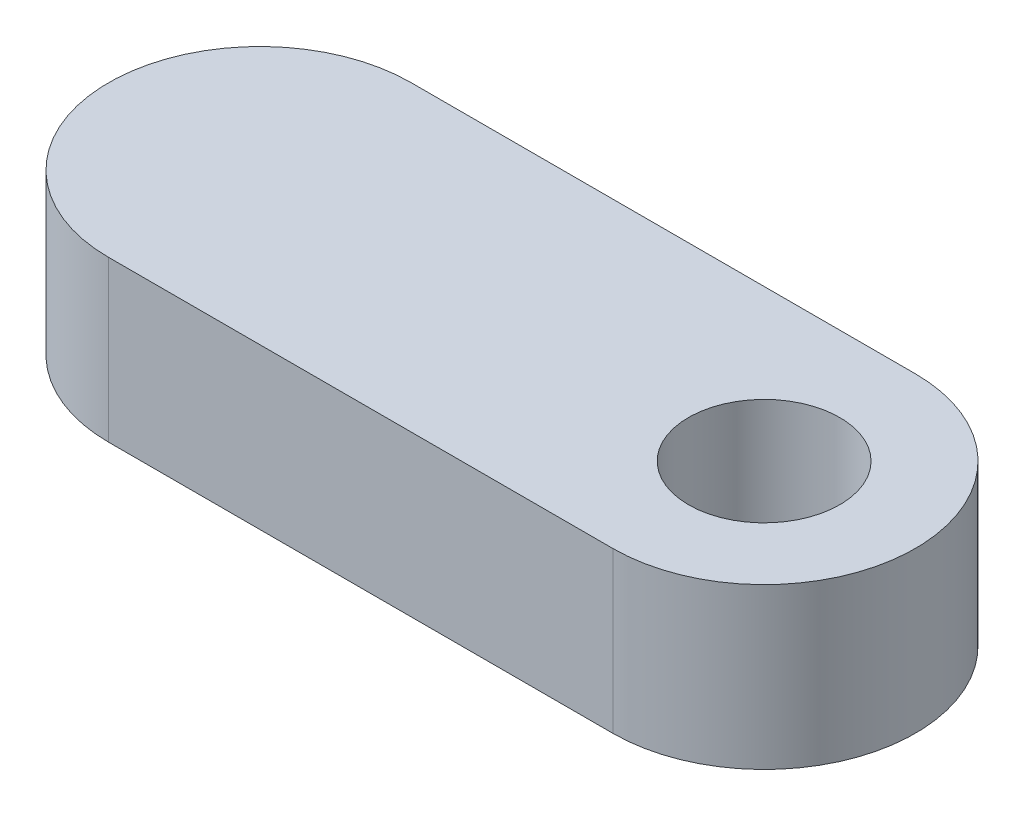
from build123d import *

# Parameters (mm, degrees)
SKETCH1_R           = 1.5
BOSS_EXTRUDE1_DEPTH = 3.175


with BuildPart() as part:
    # Sketch1 → Boss-Extrude1 (new body)
    with BuildSketch(Plane(origin=(0, 0, 0), x_dir=(1, 0, 0), z_dir=(0, 1, 0))):
        with BuildLine():
            Line((-5, 3), (5, 3))
            ThreePointArc((5, 3), (8, 0), (5, -3))
            Line((5, -3), (-5, -3))
            ThreePointArc((-5, -3), (-8, 0), (-5, 3))
        make_face()
        with Locations(Location((5, 0, 0), (0, 0, 270))):
            Circle(SKETCH1_R, mode=Mode.SUBTRACT)
    extrude(amount=BOSS_EXTRUDE1_DEPTH)


solid = part.part
